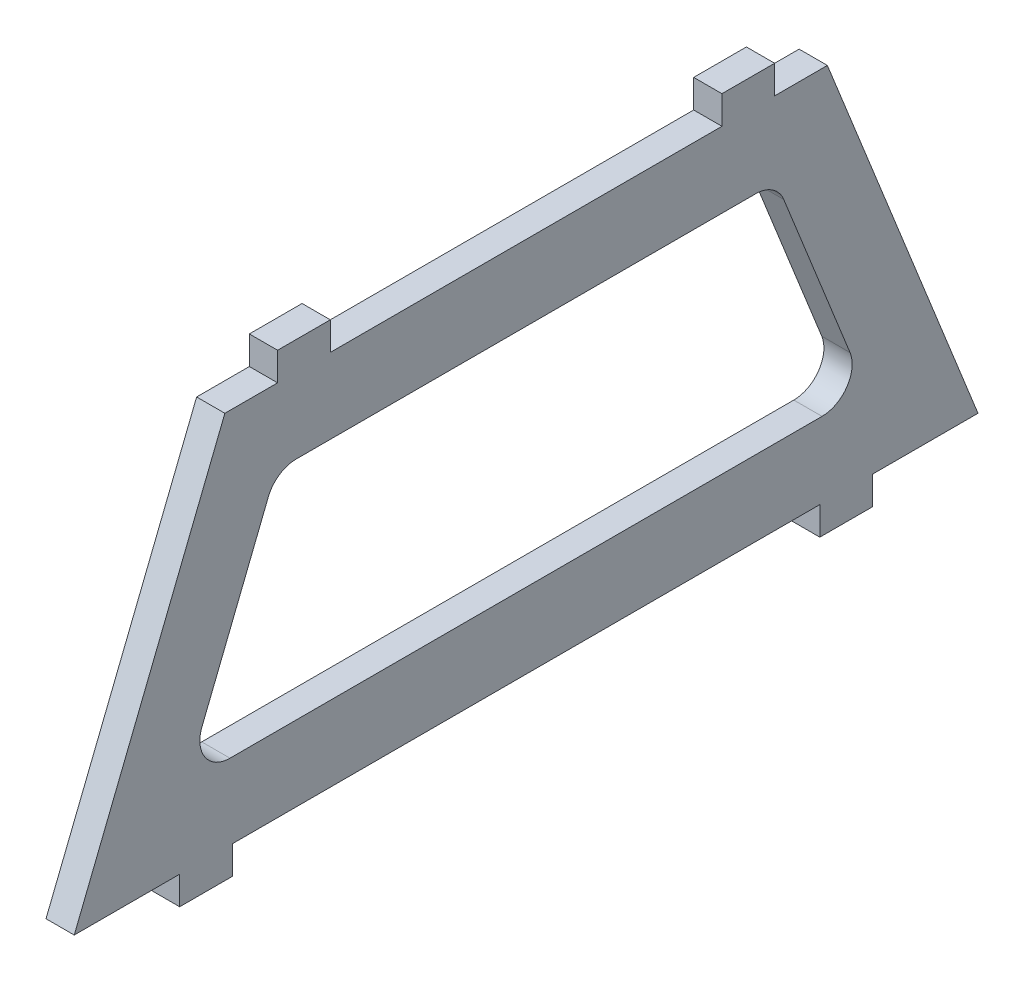
from build123d import *

# Parameters (mm, degrees)
BOSS_EXTRUDE1_DEPTH = 4.7625
SKETCH2_W           = 84.36568139
SKETCH2_H           = 38.1
CUT_EXTRUDE1_DEPTH  = 4.7625
FILLET1_R           = 5.08


with BuildPart() as part:
    # Sketch1 → Boss-Extrude1 (new body)
    with BuildSketch(Plane(origin=(0, 0, 0), x_dir=(0, 0, -1), z_dir=(1, 0, 0))):
        Polygon((-92.71, 63.5), (-101.6, 63.5), (-127, 0), (-109.22, 0), (-109.22, -4.7625), (-100.33, -4.7625), (-100.33, 0), (-1.27, 0), (-1.27, -4.7625), (7.62, -4.7625), (7.62, 0), (25.4, 0), (0, 63.5), (-8.89, 63.5), (-8.89, 68.2625), (-17.78, 68.2625), (-17.78, 63.5), (-83.82, 63.5), (-83.82, 68.2625), (-92.71, 68.2625), align=None)
    extrude(amount=BOSS_EXTRUDE1_DEPTH)

    # Sketch2 → Cut-Extrude1 (cut)
    with BuildSketch(Plane(origin=(4.7625, 0, 0), x_dir=(0, 0, -1), z_dir=(1, 0, 0))):
        with Locations((-50.818840695, 31.75)):
            Rectangle(SKETCH2_W, SKETCH2_H)
        Polygon((-93.00168139, 12.7), (-93.00168139, 50.8), (-108.24168139, 12.7), align=None)
        Polygon((6.604, 12.7), (-8.636, 50.8), (-8.636, 12.7), align=None)
    extrude(amount=-CUT_EXTRUDE1_DEPTH, mode=Mode.SUBTRACT)

    # Fillet1
    fillet1_edges = [part.edges().sort_by_distance(p)[0] for p in [
        (2.38125, 12.7, 108.24168139),
        (2.38125, 50.8, 93.00168139),
        (2.38125, 50.8, 8.636),
        (2.38125, 12.7, -6.604),
    ]]
    fillet(fillet1_edges, radius=FILLET1_R)


solid = part.part
